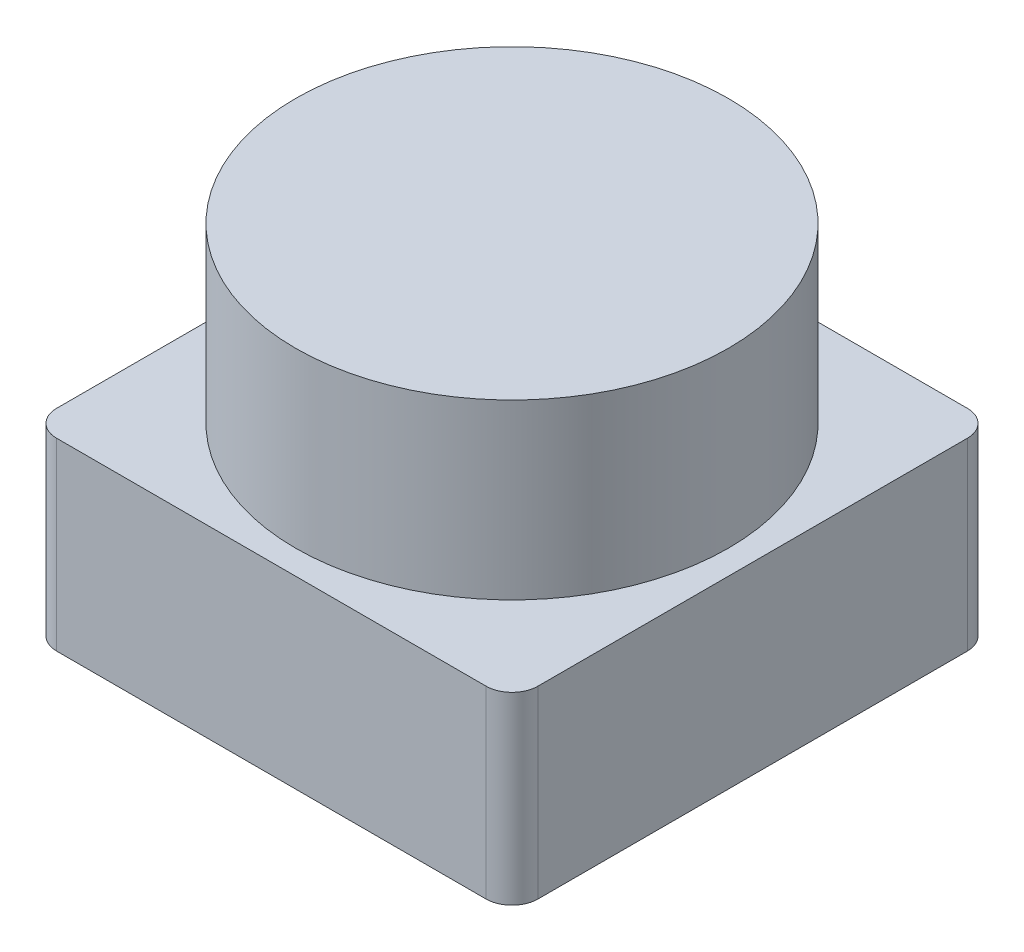
from build123d import *

# Parameters (mm, degrees)
SKETCH_1_W          = 55.6
SKETCH_1_H          = 55.6
EXTRUDE_1_DEPTH     = 21.3
EXTRUDE_2_DEPTH     = 20
FILLET_1_R          = 3
HOLE_WIZARD_1_D     = 3
HOLE_WIZARD_1_DEPTH = 4


with BuildPart() as part:
    # 草图1 → 凸台-拉伸1 (new body)
    with BuildSketch(Plane(origin=(0, 0, 0), x_dir=(1, 0, 0), z_dir=(0, 1, 0))):
        with Locations((27.8, 27.8)):
            Rectangle(SKETCH_1_W, SKETCH_1_H)
    extrude(amount=EXTRUDE_1_DEPTH)

    # 草图2 → 凸台-拉伸2 (add)
    with BuildSketch(Plane(origin=(0, 21.3, 0), x_dir=(1, 0, 0), z_dir=(0, 1, 0))):
        with BuildLine():
            ThreePointArc((52.8, 27.8), (37.367085809, 50.896988313), (10.12233047, 45.47766953))
            Line((10.12233047, 45.47766953), (45.47766953, 10.12233047))
            ThreePointArc((45.47766953, 10.12233047), (50.896988313, 18.232914191), (52.8, 27.8))
        make_face()
        with BuildLine():
            Line((45.47766953, 10.12233047), (10.12233047, 45.47766953))
            ThreePointArc((10.12233047, 45.47766953), (10.12233047, 10.12233047), (45.47766953, 10.12233047))
        make_face()
    extrude(amount=EXTRUDE_2_DEPTH)

    # 圆角1
    fillet_1_edges = [part.edges().sort_by_distance(p)[0] for p in [
        (0, 10.65, -55.6),
        (55.6, 10.65, -55.6),
        (55.6, 10.65, 0),
        (0, 10.65, 0),
    ]]
    fillet(fillet_1_edges, radius=FILLET_1_R)

    # 孔1
    with Locations(Plane(origin=(0, 0, 0), x_dir=(-1, 0, 0), z_dir=(0, -1, 0))):
        with Locations((-49.3, 49.3), (-6.3, 49.3), (-6.3, 6.3), (-49.3, 6.3)):
            Hole(HOLE_WIZARD_1_D / 2, depth=HOLE_WIZARD_1_DEPTH)


solid = part.part
